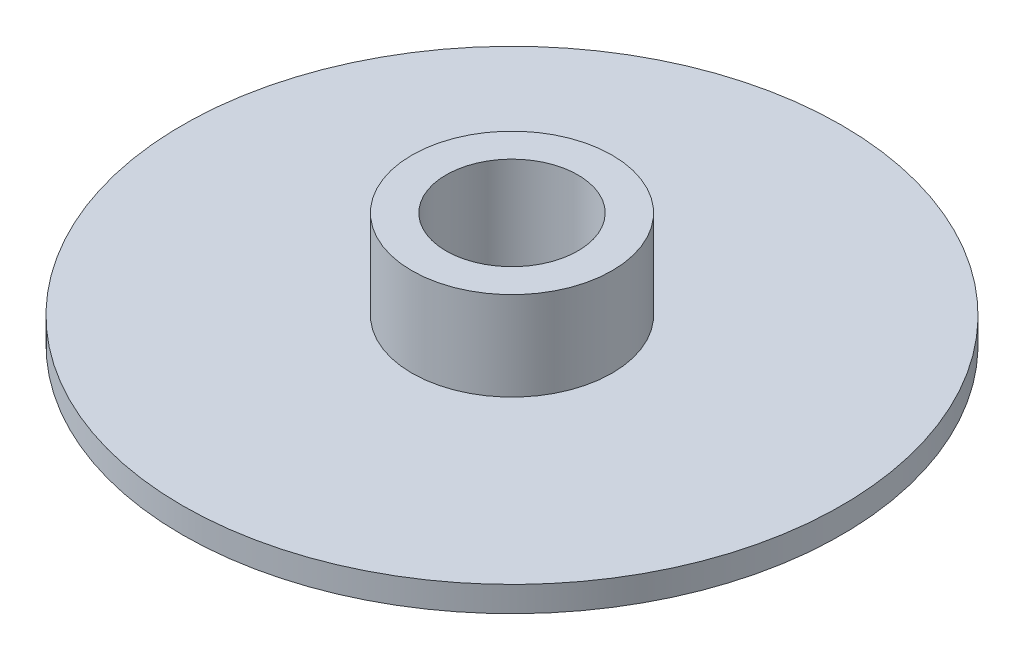
from build123d import *

# Parameters (mm, degrees)
CROQUIS1_R              = 13
SALIENTE_EXTRUIR1_DEPTH = 1
CROQUIS2_R              = 3.95
SALIENTE_EXTRUIR2_DEPTH = 3.5
CROQUIS3_R              = 2.6
CORTAR_EXTRUIR1_DEPTH   = 19.927493231


with BuildPart() as part:
    # Croquis1 → Saliente-Extruir1 (new body)
    with BuildSketch(Plane(origin=(0, 0, 0), x_dir=(1, 0, 0), z_dir=(0, 1, 0))):
        with Locations(Location((0, 0, 0), (0, 0, 270))):
            Circle(CROQUIS1_R)
    extrude(amount=SALIENTE_EXTRUIR1_DEPTH)

    # Croquis2 → Saliente-Extruir2 (add)
    with BuildSketch(Plane(origin=(0, 1, 0), x_dir=(1, 0, 0), z_dir=(0, 1, 0))):
        with Locations(Location((0, 0, 0), (0, 0, 270))):
            Circle(CROQUIS2_R)
    extrude(amount=SALIENTE_EXTRUIR2_DEPTH)

    # Croquis3 → Cortar-Extruir1 (cut, through all)
    with BuildSketch(Plane(origin=(0, 4.5, 0), x_dir=(1, 0, 0), z_dir=(0, 1, 0))):
        with Locations(Location((0, 0, 0), (0, 0, 270))):
            Circle(CROQUIS3_R)
    extrude(amount=-CORTAR_EXTRUIR1_DEPTH, mode=Mode.SUBTRACT)


solid = part.part
